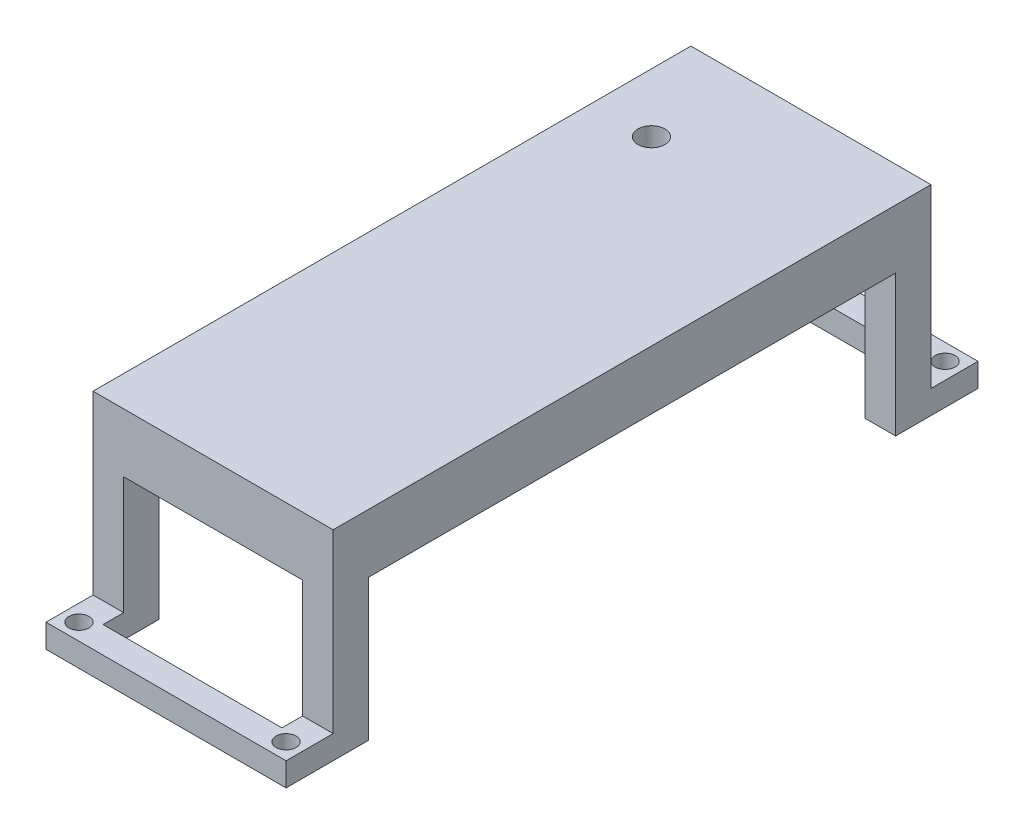
from build123d import *

# Parameters (mm, degrees)
SKETCH1_R           = 4.25
BOSS_EXTRUDE1_DEPTH = 10
BOSS_EXTRUDE2_START = -5
BOSS_EXTRUDE2_DEPTH = 15
SKETCH3_W           = 102
SKETCH3_H           = 25
BOSS_EXTRUDE3_DEPTH = 224
CUT_EXTRUDE1_REACH  = 268.845
SKETCH4_R           = 5.75


with BuildPart() as part:
    # Sketch1 → Boss-Extrude1 (new body)
    with BuildSketch(Plane(origin=(0, 0, 0), x_dir=(1, 0, 0), z_dir=(0, 1, 0))):
        Polygon((-51, 11.25), (51, 11.25), (51, 0), (51, -13.75), (38, -13.75), (38, 0), (-38, 0), (-38, -13.75), (-51, -13.75), align=None)
        with Locations(Location((-44, 4.25, 0), (0, 0, 270))):
            Circle(SKETCH1_R, mode=Mode.SUBTRACT)
        with Locations(Location((44, 4.25, 0), (0, 0, 90))):
            Circle(SKETCH1_R, mode=Mode.SUBTRACT)
    boss_extrude1 = extrude(amount=BOSS_EXTRUDE1_DEPTH)

    # Sketch2 → Boss-Extrude2 (add)
    with BuildSketch(Plane.XY.offset(13.75).offset(BOSS_EXTRUDE2_START)):
        Polygon((-51, 85), (-51, 0), (-38, 0), (-38, 60), (38, 60), (38, 0), (51, 0), (51, 85), align=None)
    boss_extrude2 = extrude(amount=BOSS_EXTRUDE2_DEPTH)

    # Sketch3 → Boss-Extrude3 (add)
    with BuildSketch(Plane.XY.offset(23.75)):
        with Locations((0, 72.5)):
            Rectangle(SKETCH3_W, SKETCH3_H)
    extrude(amount=BOSS_EXTRUDE3_DEPTH)

    # Sketch4 → Cut-Extrude1 (cut, up to next)
    with BuildSketch(Plane(origin=(0, 85, 0), x_dir=(1, 0, 0), z_dir=(0, 1, 0)), mode=Mode.PRIVATE) as cut_extrude1_sk1:
        with Locations(Location((-26, -50.5, 0), (0, 0, 270))):
            Circle(SKETCH4_R)
    cut_extrude1_tool1 = extrude(cut_extrude1_sk1.sketch, amount=-CUT_EXTRUDE1_REACH, mode=Mode.PRIVATE) & part.part
    add(cut_extrude1_tool1.solids().sort_by_distance((-26, 85, 50.5))[0], mode=Mode.SUBTRACT)

    # Mirror3: Boss-Extrude2 across plane
    add(boss_extrude2.mirror(Plane(origin=(0, 0, 135.75), x_dir=(1, 0, 0), z_dir=(0, 0, -1))))

    # Mirror4: Boss-Extrude1 across plane
    add(boss_extrude1.mirror(Plane(origin=(0, 0, 135.75), x_dir=(1, 0, 0), z_dir=(0, 0, -1))))


solid = part.part
